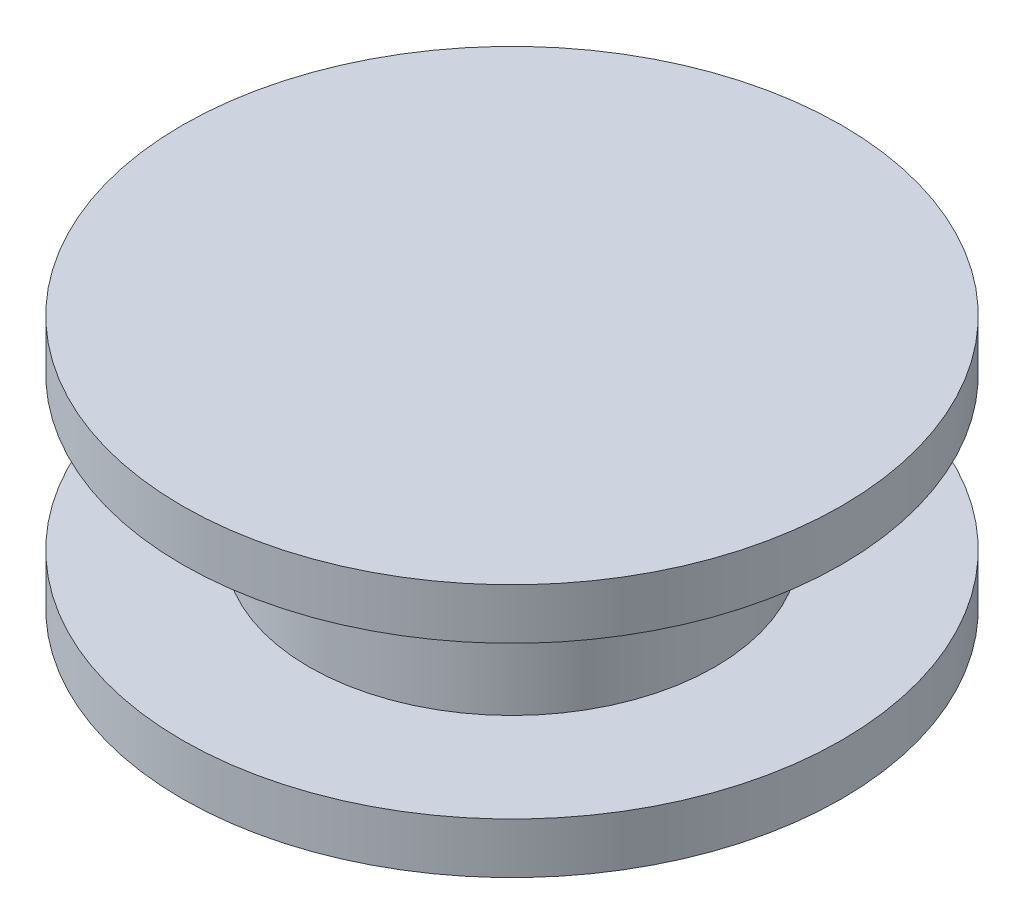
from build123d import *

# Parameters (mm, degrees)
SKETCH1_R           = 20
BOSS_EXTRUDE1_DEPTH = 10
SKETCH2_R           = 32.5
BOSS_EXTRUDE2_DEPTH = 5
BOSS_EXTRUDE3_START = -20
SKETCH2_2_R         = 32.5
BOSS_EXTRUDE3_DEPTH = 5


with BuildPart() as part:
    # Sketch1 → Boss-Extrude1 (new, symmetric)
    with BuildSketch(Plane(origin=(0, 0, 0), x_dir=(1, 0, 0), z_dir=(0, 1, 0))):
        with Locations(Location((0, 0, 0), (0, 0, 270))):
            Circle(SKETCH1_R)
    extrude(amount=BOSS_EXTRUDE1_DEPTH, both=True)

    # Sketch2 → Boss-Extrude2 (add)
    with BuildSketch(Plane(origin=(0, 10, 0), x_dir=(1, 0, 0), z_dir=(0, 1, 0))):
        with Locations(Location((0, 0, 0), (0, 0, 270))):
            Circle(SKETCH2_R)
    extrude(amount=BOSS_EXTRUDE2_DEPTH)

    # Sketch2<2> → Boss-Extrude3 (add)
    with BuildSketch(Plane(origin=(0, 10, 0), x_dir=(1, 0, 0), z_dir=(0, 1, 0)).offset(BOSS_EXTRUDE3_START)):
        with Locations(Location((0, 0, 0), (0, 0, 270))):
            Circle(SKETCH2_2_R)
    extrude(amount=BOSS_EXTRUDE3_DEPTH)


solid = part.part
